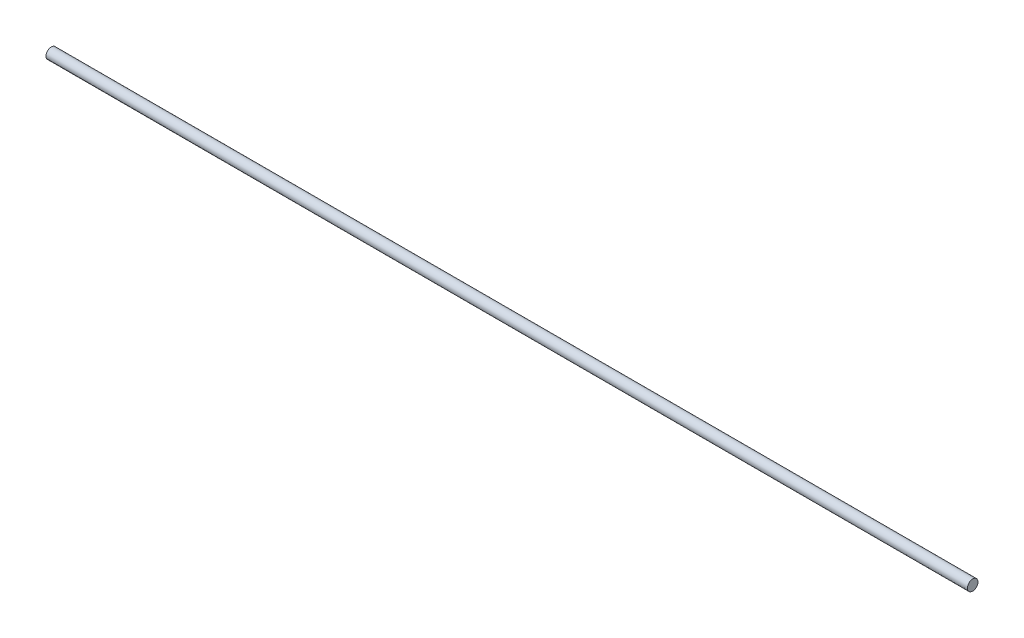
from build123d import *

# Parameters (mm, degrees)
SKETCH1_R           = 6.35
BOSS_EXTRUDE1_DEPTH = 553.212


with BuildPart() as part:
    # Sketch1 → Boss-Extrude1 (new, symmetric)
    with BuildSketch(Plane(origin=(0, 0, 0), x_dir=(0, 0, -1), z_dir=(1, 0, 0))):
        Circle(SKETCH1_R)
    extrude(amount=BOSS_EXTRUDE1_DEPTH, both=True)


solid = part.part
